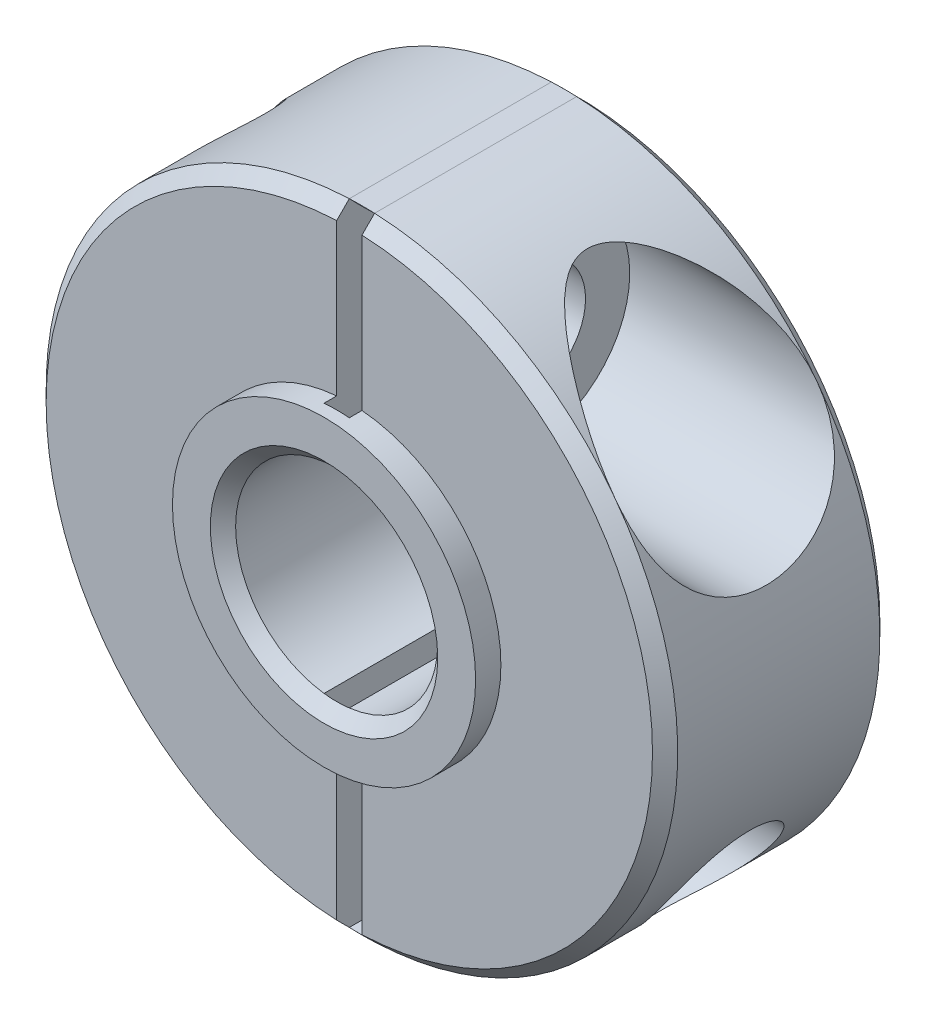
from build123d import *

# Parameters (mm, degrees)
CROQUIS1_R              = 12.5
CROQUIS1_R_2            = 4
SALIENTE_EXTRUIR1_DEPTH = 10
CROQUIS2_OUTSIDE_W      = 34.348
CROQUIS2_OUTSIDE_H      = 34.348
CROQUIS2_OUTSIDE_R      = 6
CORTAR_EXTRUIR1_DEPTH   = 1
CHAFL_N1_SIZE           = 0.5
CROQUIS3_W              = 1
CROQUIS3_H              = 24.979991994
CORTAR_EXTRUIR2_DEPTH   = 9.5
MATRIZC1_COUNT          = 2
MATRIZC1_ANGLE          = 180


with BuildPart() as part:
    # Croquis1 → Saliente-Extruir1 (new body)
    with BuildSketch(Plane.XY):
        Circle(CROQUIS1_R)
        Circle(CROQUIS1_R_2, mode=Mode.SUBTRACT)
    extrude(amount=SALIENTE_EXTRUIR1_DEPTH)

    # Croquis2 outside → Cortar-Extruir1 (cut)
    with BuildSketch(Plane.XY.offset(10)):
        Rectangle(CROQUIS2_OUTSIDE_W, CROQUIS2_OUTSIDE_H)
        Circle(CROQUIS2_OUTSIDE_R, mode=Mode.SUBTRACT)
    extrude(amount=-CORTAR_EXTRUIR1_DEPTH, mode=Mode.SUBTRACT)

    # Chaflán1
    chafl_n1_edges = [part.edges().sort_by_distance(p)[0] for p in [
        (-12.5, 0, 9),
        (-12.5, 0, 0),
        (-4, 0, 0),
        (-4, 0, 10),
    ]]
    chamfer(chafl_n1_edges, length=CHAFL_N1_SIZE)

    # Croquis3 → Cortar-Extruir2 (cut)
    with BuildSketch(Plane.XY):
        Rectangle(CROQUIS3_W, CROQUIS3_H)
    extrude(amount=CORTAR_EXTRUIR2_DEPTH, mode=Mode.SUBTRACT)

    # Croquis8 → Refrentado para tornillo con cabeza troncocónica de M45 (revolve, cut)
    with BuildSketch(Plane(origin=(13, 7.489995997, 4.5), x_dir=(0, 0, -1), z_dir=(0, 1, 0))):
        Polygon((0, 0), (0, 31.351936393), (2.25, 30), (2.25, 10.4), (4, 10.4), (4, 0), align=None)
    refrentado_para_tornillo_con_cabeza_tron = revolve(axis=Axis((19.35, 7.489995997, 4.5), (-1, 0, 0)), mode=Mode.SUBTRACT)

    # MatrizC1: Refrentado para tornillo con cabeza troncocónica de M45 ×2 about axis
    matrizc1_axis = Axis((0, 0, 9.5), (0, 0, -1))
    for i in range(1, MATRIZC1_COUNT):
        add(refrentado_para_tornillo_con_cabeza_tron.rotate(matrizc1_axis, i * MATRIZC1_ANGLE / (MATRIZC1_COUNT - 1)), mode=Mode.SUBTRACT)


solid = part.part
